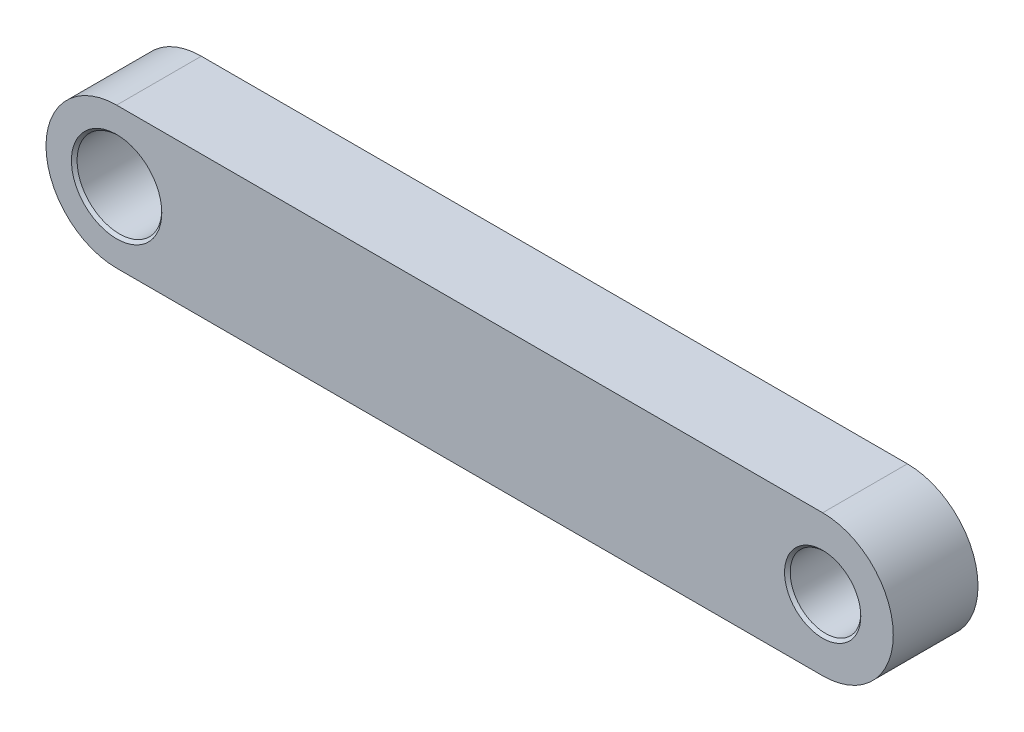
from build123d import *

# Parameters (mm, degrees)
SKETCH1_R           = 2.5
SKETCH1_R_2         = 3
BOSS_EXTRUDE1_DEPTH = 3
CHAMFER_1_SIZE      = 0.2


with BuildPart() as part:
    # Sketch1 → Boss-Extrude1 (new, symmetric)
    with BuildSketch(Plane.XY):
        with BuildLine():
            Line((0, 5), (50, 5))
            ThreePointArc((50, 5), (55, 0), (50, -5))
            Line((50, -5), (0, -5))
            ThreePointArc((0, -5), (-5, 0), (0, 5))
        make_face()
        with Locations((50, 0)):
            Circle(SKETCH1_R, mode=Mode.SUBTRACT)
        Circle(SKETCH1_R_2, mode=Mode.SUBTRACT)
    extrude(amount=BOSS_EXTRUDE1_DEPTH, both=True)

    # 倒角1
    chamfer_1_edges = [part.edges().sort_by_distance(p)[0] for p in [
        (47.5, 0, -3),
        (47.5, 0, 3),
        (-3, 0, -3),
        (-3, 0, 3),
    ]]
    chamfer(chamfer_1_edges, length=CHAMFER_1_SIZE)


solid = part.part
